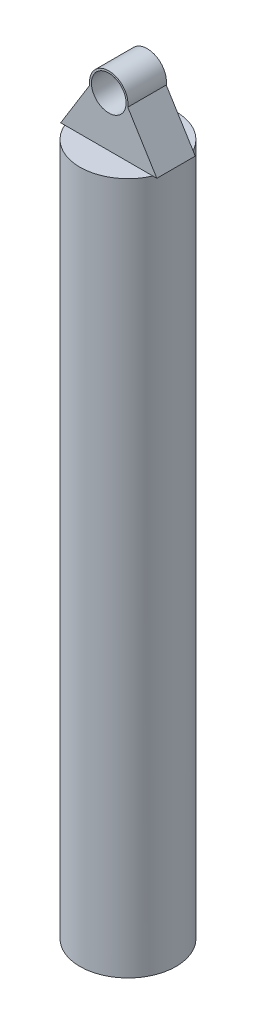
from build123d import *

# Parameters (mm, degrees)
BOSS_EXTRUDE1_DEPTH      = 1400
BOSS_EXTRUDE1_DEPTH_BACK = 400
SKETCH1_R                = 125
BOSS_EXTRUDE2_DEPTH      = 50


with BuildPart() as part:
    # Sketch1 → Boss-Extrude1 (new, two sides: drawn at the far end of the back side and taken through both)
    with BuildSketch(Plane(origin=(0, 0, 0), x_dir=(1, 0, 0), z_dir=(0, 1, 0)).offset(-BOSS_EXTRUDE1_DEPTH_BACK)):
        with Locations(Location((0, 0, 0), (0, 0, 270))):
            Circle(SKETCH1_R)
    extrude(amount=BOSS_EXTRUDE1_DEPTH + BOSS_EXTRUDE1_DEPTH_BACK)

    # Sketch2 → Boss-Extrude2 (add, symmetric)
    with BuildSketch(Plane.XY):
        with BuildLine():
            ThreePointArc((49.472820857, 1522.279340233), (0, 1479.520886781), (-49.472820857, 1522.279340233))
            Line((-49.472820857, 1522.279340233), (-125, 1400))
            Line((-125, 1400), (125, 1400))
            Line((125, 1400), (49.472820857, 1522.279340233))
        make_face()
        with BuildLine():
            ThreePointArc((45, 1529.520886781), (0, 1484.520886781), (-45, 1529.520886781))
            Line((-45, 1529.520886781), (-49.472820857, 1522.279340233))
            ThreePointArc((-49.472820857, 1522.279340233), (0, 1479.520886781), (49.472820857, 1522.279340233))
            Line((49.472820857, 1522.279340233), (45, 1529.520886781))
        make_face()
        with BuildLine():
            Line((-49.472820857, 1522.279340233), (-45, 1529.520886781))
            ThreePointArc((-45, 1529.520886781), (0, 1574.520886781), (45, 1529.520886781))
            Line((45, 1529.520886781), (49.472820857, 1522.279340233))
            ThreePointArc((49.472820857, 1522.279340233), (49.868031056, 1525.890531625), (50, 1529.520886781))
            ThreePointArc((50, 1529.520886781), (-3.630355157, 1579.388917838), (-49.472820857, 1522.279340233))
        make_face()
    extrude(amount=BOSS_EXTRUDE2_DEPTH, both=True)


solid = part.part
